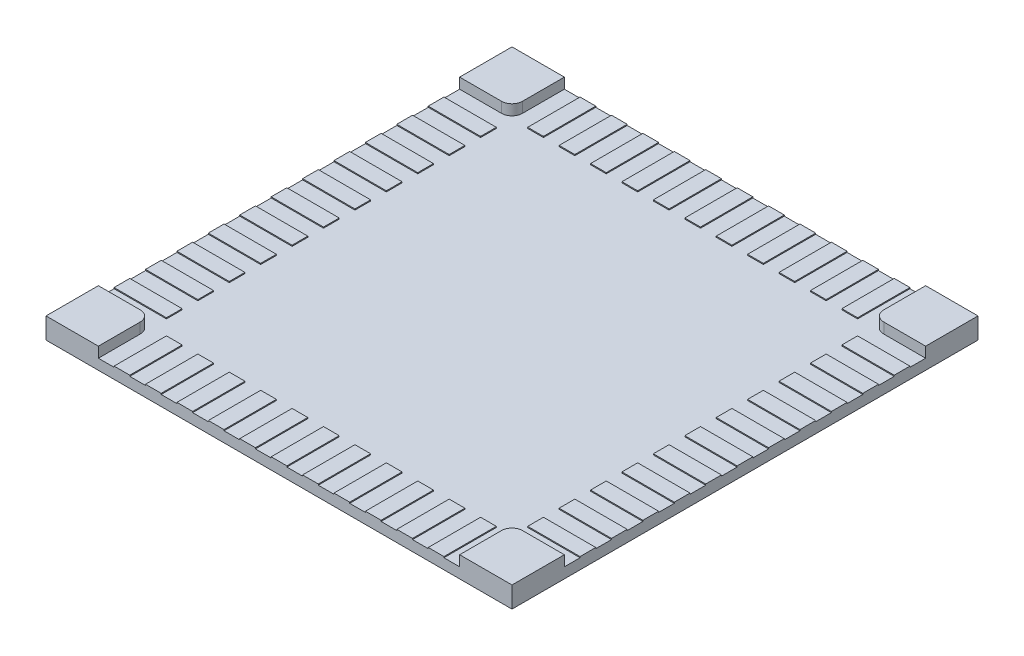
from build123d import *

# Parameters (mm, degrees)
SKETCH1_W           = 89
SKETCH1_H           = 89
BOSS_EXTRUDE1_DEPTH = 2
SKETCH2_W           = 10
SKETCH2_H           = 10
BOSS_EXTRUDE2_DEPTH = 2
SKETCH3_W           = 10
SKETCH3_H           = 3
SKETCH3_W_2         = 3
SKETCH3_H_2         = 10
BOSS_EXTRUDE3_DEPTH = 0.2
FILLET1_R           = 2


with BuildPart() as part:
    # Sketch1 → Boss-Extrude1 (new body)
    with BuildSketch(Plane(origin=(0, 0, 0), x_dir=(1, 0, 0), z_dir=(0, 1, 0))):
        Rectangle(SKETCH1_W, SKETCH1_H)
    extrude(amount=BOSS_EXTRUDE1_DEPTH)

    # Sketch2 → Boss-Extrude2 (add)
    with BuildSketch(Plane(origin=(0, 2, 0), x_dir=(1, 0, 0), z_dir=(0, 1, 0))):
        with Locations((-39.5, 39.5)):
            Rectangle(SKETCH2_W, SKETCH2_H)
        with Locations((39.5, 39.5)):
            Rectangle(SKETCH2_W, SKETCH2_H)
        with Locations((39.5, -39.5)):
            Rectangle(SKETCH2_W, SKETCH2_H)
        with Locations((-39.5, -39.5)):
            Rectangle(SKETCH2_W, SKETCH2_H)
    extrude(amount=BOSS_EXTRUDE2_DEPTH)

    # Sketch3 → Boss-Extrude3 (add)
    with BuildSketch(Plane(origin=(0, 2, 0), x_dir=(1, 0, 0), z_dir=(0, 1, 0))):
        with Locations((-39.5, 30)):
            Rectangle(SKETCH3_W, SKETCH3_H)
        with Locations((-30, 39.5)):
            Rectangle(SKETCH3_W_2, SKETCH3_H_2)
        with Locations((-39.5, 24)):
            Rectangle(SKETCH3_W, SKETCH3_H)
        with Locations((-24, 39.5)):
            Rectangle(SKETCH3_W_2, SKETCH3_H_2)
        with Locations((-39.5, 18)):
            Rectangle(SKETCH3_W, SKETCH3_H)
        with Locations((-18, 39.5)):
            Rectangle(SKETCH3_W_2, SKETCH3_H_2)
        with Locations((-39.5, 12)):
            Rectangle(SKETCH3_W, SKETCH3_H)
        with Locations((-12, 39.5)):
            Rectangle(SKETCH3_W_2, SKETCH3_H_2)
        with Locations((-39.5, 6)):
            Rectangle(SKETCH3_W, SKETCH3_H)
        with Locations((-6, 39.5)):
            Rectangle(SKETCH3_W_2, SKETCH3_H_2)
        with Locations((-39.5, 0)):
            Rectangle(SKETCH3_W, SKETCH3_H)
        with Locations((0, 39.5)):
            Rectangle(SKETCH3_W_2, SKETCH3_H_2)
        with Locations((-39.5, -6)):
            Rectangle(SKETCH3_W, SKETCH3_H)
        with Locations((6, 39.5)):
            Rectangle(SKETCH3_W_2, SKETCH3_H_2)
        with Locations((-39.5, -12)):
            Rectangle(SKETCH3_W, SKETCH3_H)
        with Locations((12, 39.5)):
            Rectangle(SKETCH3_W_2, SKETCH3_H_2)
        with Locations((-39.5, -18)):
            Rectangle(SKETCH3_W, SKETCH3_H)
        with Locations((18, 39.5)):
            Rectangle(SKETCH3_W_2, SKETCH3_H_2)
        with Locations((-39.5, -24)):
            Rectangle(SKETCH3_W, SKETCH3_H)
        with Locations((24, 39.5)):
            Rectangle(SKETCH3_W_2, SKETCH3_H_2)
        with Locations((-39.5, -30)):
            Rectangle(SKETCH3_W, SKETCH3_H)
        with Locations((30, 39.5)):
            Rectangle(SKETCH3_W_2, SKETCH3_H_2)
        with Locations((-30, -39.5)):
            Rectangle(SKETCH3_W_2, SKETCH3_H_2)
        with Locations((39.5, 30)):
            Rectangle(SKETCH3_W, SKETCH3_H)
        with Locations((-24, -39.5)):
            Rectangle(SKETCH3_W_2, SKETCH3_H_2)
        with Locations((39.5, 24)):
            Rectangle(SKETCH3_W, SKETCH3_H)
        with Locations((-18, -39.5)):
            Rectangle(SKETCH3_W_2, SKETCH3_H_2)
        with Locations((39.5, 18)):
            Rectangle(SKETCH3_W, SKETCH3_H)
        with Locations((-12, -39.5)):
            Rectangle(SKETCH3_W_2, SKETCH3_H_2)
        with Locations((39.5, 12)):
            Rectangle(SKETCH3_W, SKETCH3_H)
        with Locations((-6, -39.5)):
            Rectangle(SKETCH3_W_2, SKETCH3_H_2)
        with Locations((39.5, 6)):
            Rectangle(SKETCH3_W, SKETCH3_H)
        with Locations((0, -39.5)):
            Rectangle(SKETCH3_W_2, SKETCH3_H_2)
        with Locations((39.5, 0)):
            Rectangle(SKETCH3_W, SKETCH3_H)
        with Locations((6, -39.5)):
            Rectangle(SKETCH3_W_2, SKETCH3_H_2)
        with Locations((39.5, -6)):
            Rectangle(SKETCH3_W, SKETCH3_H)
        with Locations((12, -39.5)):
            Rectangle(SKETCH3_W_2, SKETCH3_H_2)
        with Locations((39.5, -12)):
            Rectangle(SKETCH3_W, SKETCH3_H)
        with Locations((18, -39.5)):
            Rectangle(SKETCH3_W_2, SKETCH3_H_2)
        with Locations((39.5, -18)):
            Rectangle(SKETCH3_W, SKETCH3_H)
        with Locations((24, -39.5)):
            Rectangle(SKETCH3_W_2, SKETCH3_H_2)
        with Locations((39.5, -24)):
            Rectangle(SKETCH3_W, SKETCH3_H)
        with Locations((30, -39.5)):
            Rectangle(SKETCH3_W_2, SKETCH3_H_2)
        with Locations((39.5, -30)):
            Rectangle(SKETCH3_W, SKETCH3_H)
    extrude(amount=BOSS_EXTRUDE3_DEPTH)

    # Fillet1
    fillet1_edges = [part.edges().sort_by_distance(p)[0] for p in [
        (-34.5, 3, -34.5),
        (34.5, 3, -34.5),
        (34.5, 3, 34.5),
        (-34.5, 3, 34.5),
    ]]
    fillet(fillet1_edges, radius=FILLET1_R)


solid = part.part
